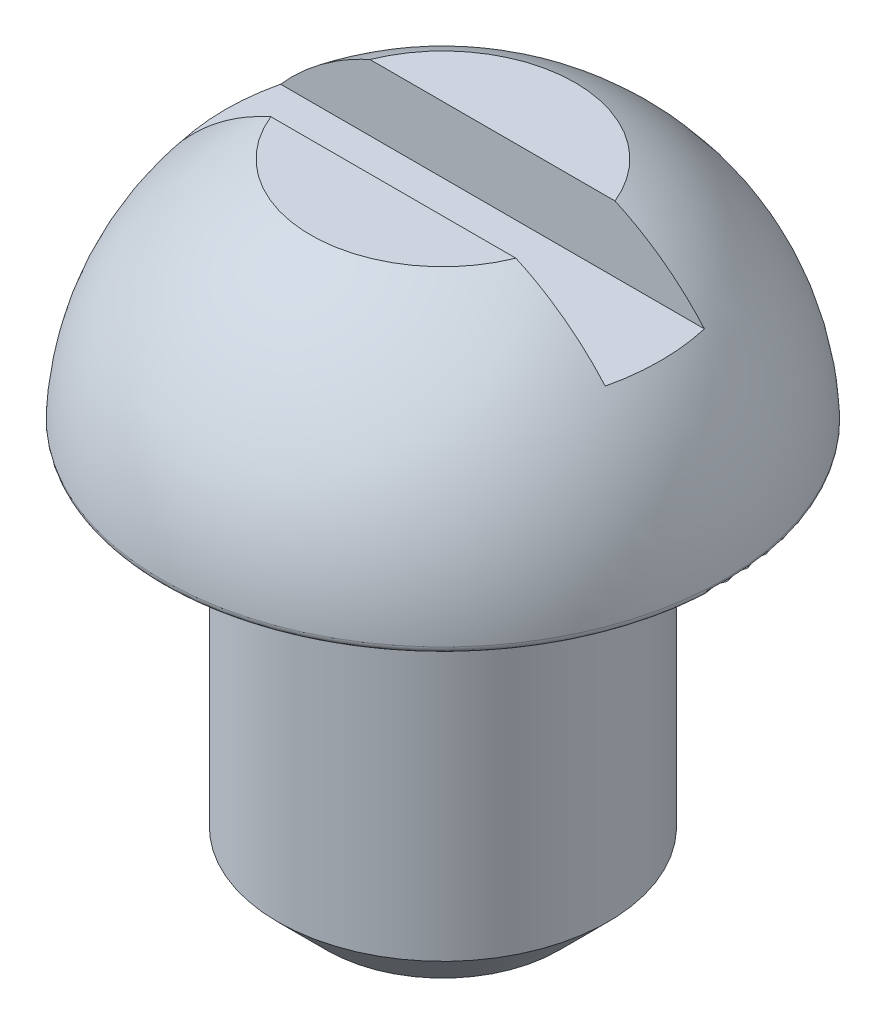
from build123d import *

# Parameters (mm, degrees)
FILLET_1_R          = 0.1
SKETCH_3_W          = 8
SKETCH_3_H          = 1.5
CUT_EXTRUDE_2_DEPTH = 1


with BuildPart() as part:
    # Эскиз1 → Повернуть1 (revolve)
    with BuildSketch(Plane.XY):
        with BuildLine():
            Line((4.25, 6), (2.5, 6))
            Line((2.5, 6), (2.5, 0.75))
            Line((2.5, 0.75), (1.75, 0))
            Line((1.75, 0), (0, 0))
            Line((0, 0), (0, 9.5))
            Line((0, 9.5), (2, 9.5))
            ThreePointArc((2, 9.5), (3.615901166, 8.065579321), (4.25, 6))
        make_face()
    revolve(axis=Axis((0, 0, 0), (0, 1, 0)))

    # Скругление1
    fillet_1_edges = [part.edges().sort_by_distance(p)[0] for p in [
        (-4.25, 6, 0),
    ]]
    fillet(fillet_1_edges, radius=FILLET_1_R)

    # Эскиз3 → Вырез-Вытянуть2 (cut)
    with BuildSketch(Plane(origin=(0, 9.5, 0), x_dir=(-1, 0, 0), z_dir=(0, 1, 0))):
        Rectangle(SKETCH_3_W, SKETCH_3_H)
    extrude(amount=-CUT_EXTRUDE_2_DEPTH, mode=Mode.SUBTRACT)


solid = part.part
